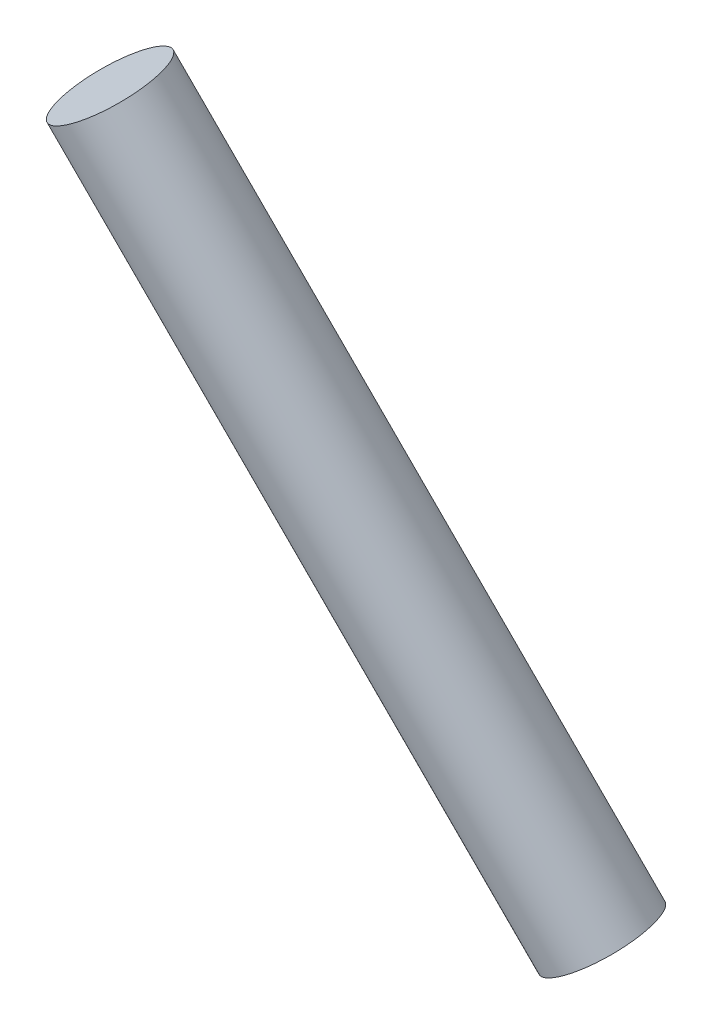
from build123d import *

# Parameters (mm, degrees)
SKETCH_4_R      = 2.5
EXTRUDE_2_DEPTH = 35


with BuildPart() as part:
    # 草图4 → 凸台-拉伸2 (new body)
    with BuildSketch(Plane(origin=(-17.407280943, 27.380562957, 4.98829158), x_dir=(0.8478236687587924, 0.5216912267508507, 0.09504362484445801), z_dir=(0.5302782540255461, -0.8340944899503148, -0.15195839938003722))):
        with Locations(Location((0, 0, 0), (0, 0, 354.481891508))):
            Circle(SKETCH_4_R)
    extrude(amount=-EXTRUDE_2_DEPTH)


solid = part.part
